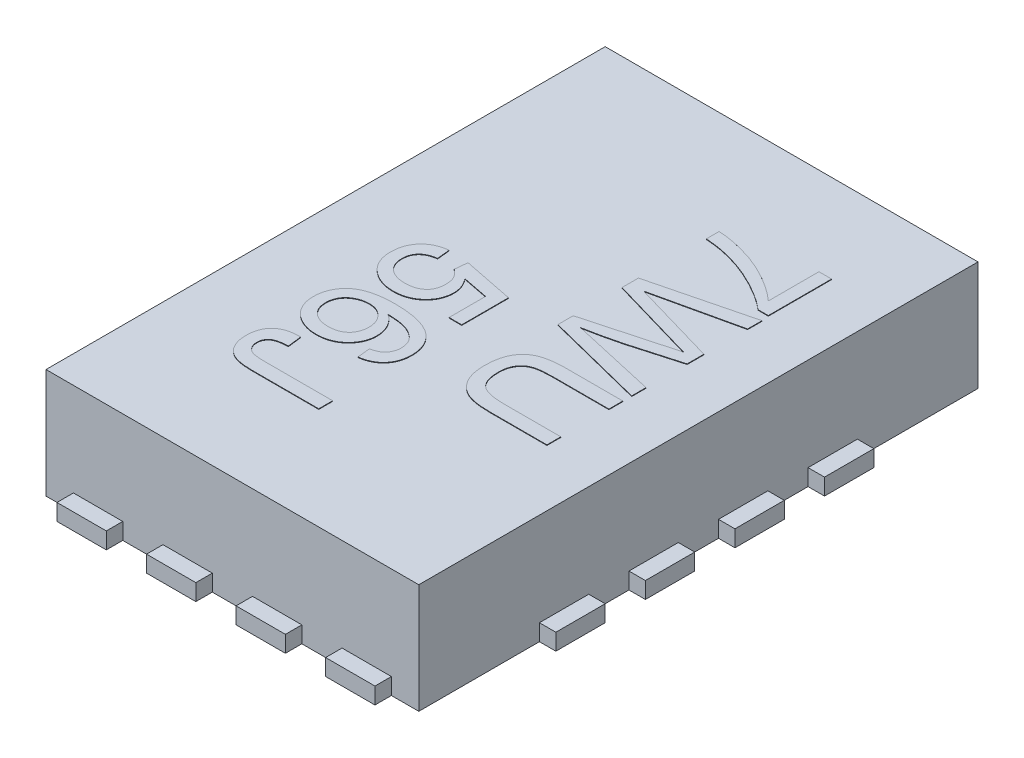
from build123d import *

# Parameters (mm, degrees)
SKETCH1_W           = 1.7272
SKETCH1_H           = 2.5908
BOSS_EXTRUDE1_DEPTH = 0.508
SKETCH2_W           = 0.2286
SKETCH2_H           = 0.0762
BOSS_EXTRUDE3_DEPTH = 0.0762
SKETCH4_W           = 0.2286
SKETCH4_H           = 0.0762
BOSS_EXTRUDE4_DEPTH = 0.0762
BOSS_EXTRUDE5_DEPTH = 0.00254


with BuildPart() as part:
    # Sketch1 → Boss-Extrude1 (new body)
    with BuildSketch(Plane(origin=(0, 0, 0), x_dir=(1, 0, 0), z_dir=(0, 1, 0))):
        Rectangle(SKETCH1_W, SKETCH1_H)
    extrude(amount=BOSS_EXTRUDE1_DEPTH)

    # Sketch2 → Boss-Extrude3 (add)
    with BuildSketch(Plane.XY.offset(1.2954)):
        with Locations((-0.6223, 0.0381)):
            Rectangle(SKETCH2_W, SKETCH2_H)
        with Locations((-0.207433333, 0.0381)):
            Rectangle(SKETCH2_W, SKETCH2_H)
        with Locations((0.207433333, 0.0381)):
            Rectangle(SKETCH2_W, SKETCH2_H)
        with Locations((0.6223, 0.0381)):
            Rectangle(SKETCH2_W, SKETCH2_H)
    boss_extrude3 = extrude(amount=BOSS_EXTRUDE3_DEPTH)

    # Sketch4 → Boss-Extrude4 (add)
    with BuildSketch(Plane(origin=(0.8636, 0, 0), x_dir=(0, 0, -1), z_dir=(1, 0, 0))):
        with Locations((-0.207433291, 0.0381)):
            Rectangle(SKETCH4_W, SKETCH4_H)
        with Locations((0.207433291, 0.0381)):
            Rectangle(SKETCH4_W, SKETCH4_H)
        with Locations((0.622299873, 0.0381)):
            Rectangle(SKETCH4_W, SKETCH4_H)
        with Locations((-0.622299873, 0.0381)):
            Rectangle(SKETCH4_W, SKETCH4_H)
    boss_extrude4 = extrude(amount=BOSS_EXTRUDE4_DEPTH)

    # Mirror1: Boss-Extrude3 across plane
    add(boss_extrude3.mirror(Plane.XY))

    # Mirror2: Boss-Extrude4 across plane
    add(boss_extrude4.mirror(Plane(origin=(0, 0, 0), x_dir=(0, 0, 1), z_dir=(1, 0, 0))))

    # Sketch5 → Boss-Extrude5 (add)
    # profile 1 of 6: a face of its own
    with BuildSketch(Plane(origin=(0, 0.508, 0), x_dir=(1, 0, 0), z_dir=(0, 1, 0))):
        with BuildLine():
            Line((0.537145835, 0.884876602), (0.595761219, 0.884876602))
            Line((0.595761219, 0.884876602), (0.595761219, 0.591799679))
            Line((0.595761219, 0.591799679), (0.548319392, 0.591799679))
            add(Edge.make_bspline(
                [(0.548319392, 0.591799679), (0.544283142, 0.595247968), (0.536030427, 0.602298507), (0.522927148, 0.612539534), (0.508844527, 0.622683272), (0.493961555, 0.632958527), (0.478101801, 0.643119637), (0.461278077, 0.65315955), (0.443649517, 0.663358137), (0.41891854, 0.676702222), (0.387240127, 0.692606897), (0.34827942, 0.709294552), (0.308858238, 0.72395699), (0.282067646, 0.731780241), (0.268705691, 0.735682131)],
                knots=[0, 0, 0, 0, 0.60330726, 1.233551424, 1.889416397, 2.575628689, 3.288828609, 4.029674647, 4.802190479, 5.603311629, 7.223308675, 8.828846205, 10.41836952, 12, 12, 12, 12], degree=3))
            add(Edge.make_bspline(
                [(0.268705691, 0.735682131), (0.259054976, 0.738211203), (0.239421839, 0.743356273), (0.208934063, 0.74898854), (0.177145965, 0.753343118), (0.15545476, 0.755053081), (0.144422758, 0.755922756)],
                knots=[0, 0, 0, 0, 0.948866074, 1.930345965, 2.947387709, 4, 4, 4, 4], degree=3))
            Line((0.144422758, 0.755922756), (0.144422758, 0.814538141))
            add(Edge.make_bspline(
                [(0.144422758, 0.814538141), (0.148973928, 0.814397417), (0.158333142, 0.814108028), (0.172715039, 0.812831663), (0.18780958, 0.811119975), (0.203581408, 0.808749386), (0.220016376, 0.805548896), (0.237180677, 0.801904926), (0.255069397, 0.79772375), (0.279754633, 0.791064695), (0.310880897, 0.78159117), (0.347700285, 0.76778436), (0.383834029, 0.751759752), (0.413156931, 0.736495121), (0.435988662, 0.723471366), (0.452555187, 0.713588996), (0.468341163, 0.70342538), (0.483460265, 0.693169217), (0.497925196, 0.68281866), (0.511600754, 0.672162879), (0.52476168, 0.66151604), (0.533054189, 0.654082756), (0.537145835, 0.650415064)],
                knots=[0, 0, 0, 0, 0.630331972, 1.296240579, 1.998302801, 2.733604721, 3.503764187, 4.316226446, 5.163113184, 6.046948427, 7.855966888, 9.665696345, 11.488019414, 13.325647182, 14.24001658, 15.127322129, 15.996171708, 16.839125122, 17.656782808, 18.458307534, 19.239306169, 20, 20, 20, 20], degree=3))
            Line((0.537145835, 0.650415064), (0.537145835, 0.884876602))
        make_face()
    # profile 2 of 6: a face of its own
    with BuildSketch(Plane(origin=(0, 0.508, 0), x_dir=(1, 0, 0), z_dir=(0, 1, 0))):
        with BuildLine():
            Line((0.144422758, 0.44150617), (0.601622758, 0.556630449))
            Line((0.601622758, 0.556630449), (0.601622758, 0.490047035))
            Line((0.601622758, 0.490047035), (0.300944152, 0.42218141))
            add(Edge.make_bspline(
                [(0.300944152, 0.42218141), (0.285436942, 0.418664191), (0.254580837, 0.411665662), (0.223707586, 0.404743168), (0.208350162, 0.401299679)],
                knots=[0, 0, 0, 0, 1.00513078, 2, 2, 2, 2], degree=3))
            add(Edge.make_bspline(
                [(0.208350162, 0.401299679), (0.213872311, 0.399669296), (0.224297123, 0.396591429), (0.239075299, 0.392430749), (0.25197328, 0.388651736), (0.263051194, 0.385432212), (0.272324606, 0.382825375), (0.279679564, 0.380574662), (0.285260103, 0.379040604), (0.288336672, 0.378131519), (0.289587421, 0.377761939)],
                knots=[0, 0, 0, 0, 1.633809233, 3.084334118, 4.356383392, 5.447555203, 6.357852567, 7.089694452, 7.629924063, 8, 8, 8, 8], degree=3))
            Line((0.289587421, 0.377761939), (0.601622758, 0.287457612))
            Line((0.601622758, 0.287457612), (0.601622758, 0.209883814))
            Line((0.601622758, 0.209883814), (0.372564825, 0.144582612))
            add(Edge.make_bspline(
                [(0.372564825, 0.144582612), (0.358414524, 0.140978895), (0.330513194, 0.133873145), (0.288953128, 0.124432009), (0.248401319, 0.115718142), (0.221580712, 0.110698792), (0.208350162, 0.108222756)],
                knots=[0, 0, 0, 0, 1.04154457, 2.053700482, 3.039894486, 4, 4, 4, 4], degree=3))
            add(Edge.make_bspline(
                [(0.208350162, 0.108222756), (0.215127144, 0.10669444), (0.229382051, 0.103479734), (0.251889306, 0.098445242), (0.276548659, 0.092853685), (0.293738742, 0.088986911), (0.302684296, 0.086974679)],
                knots=[0, 0, 0, 0, 0.862132589, 1.813435466, 2.862132822, 4, 4, 4, 4], degree=3))
            Line((0.302684296, 0.086974679), (0.601622758, 0.019475401))
            Line((0.601622758, 0.019475401), (0.601622758, -0.047108013))
            Line((0.601622758, -0.047108013), (0.144422758, 0.068107852))
            Line((0.144422758, 0.068107852), (0.144422758, 0.138995833))
            Line((0.144422758, 0.138995833), (0.493825402, 0.234520593))
            add(Edge.make_bspline(
                [(0.493825402, 0.234520593), (0.497241138, 0.235479799), (0.503729763, 0.237301934), (0.512989252, 0.239690325), (0.521132592, 0.242058821), (0.528265021, 0.243942726), (0.534314667, 0.245573088), (0.539263819, 0.247016844), (0.543209338, 0.247945428), (0.545451854, 0.248616937), (0.546396075, 0.248899679)],
                knots=[0, 0, 0, 0, 1.562239628, 2.967673567, 4.210417925, 5.296319877, 6.215971374, 6.969386481, 7.566055473, 8, 8, 8, 8], degree=3))
            add(Edge.make_bspline(
                [(0.546396075, 0.248899679), (0.540408278, 0.250594986), (0.529094284, 0.253798282), (0.513166549, 0.258542216), (0.499161243, 0.262522874), (0.490496621, 0.265045509), (0.486498479, 0.266209535)],
                knots=[0, 0, 0, 0, 1.197730334, 2.263121701, 3.198547257, 4, 4, 4, 4], degree=3))
            Line((0.486498479, 0.266209535), (0.144422758, 0.365214583))
            Line((0.144422758, 0.365214583), (0.144422758, 0.44150617))
        make_face()
    # profile 3 of 6: a face of its own
    with BuildSketch(Plane(origin=(0, 0.508, 0), x_dir=(1, 0, 0), z_dir=(0, 1, 0))):
        with BuildLine():
            Line((0.601622758, -0.375354167), (0.601622758, -0.43983109))
            Line((0.601622758, -0.43983109), (0.338586219, -0.43983109))
            add(Edge.make_bspline(
                [(0.338586219, -0.43983109), (0.332998986, -0.439764099), (0.322126222, -0.439633736), (0.306269248, -0.439035803), (0.291294397, -0.437865088), (0.277221251, -0.436091632), (0.264010943, -0.434028376), (0.251675192, -0.431492111), (0.240247072, -0.428370628), (0.229590771, -0.424832249), (0.21966058, -0.420525846), (0.210197846, -0.415637825), (0.201296514, -0.409798826), (0.192842842, -0.403279952), (0.184823947, -0.396014268), (0.177326914, -0.387924883), (0.170270374, -0.379101046), (0.163632482, -0.36957618), (0.157685929, -0.359236558), (0.152525786, -0.348084867), (0.148255661, -0.336112547), (0.14467112, -0.32338861), (0.141970882, -0.309877772), (0.139940213, -0.295633343), (0.138742669, -0.280613367), (0.138622598, -0.270337098), (0.138561219, -0.265083974)],
                knots=[0, 0, 0, 0, 1.311228972, 2.551653728, 3.723130164, 4.834785825, 5.879510353, 6.860250358, 7.788314549, 8.658288427, 9.492697459, 10.325875345, 11.154513055, 11.987074685, 12.828985206, 13.690719442, 14.572384718, 15.478595216, 16.41253076, 17.367739602, 18.35808817, 19.392369757, 20.467218117, 21.588802345, 22.767420464, 24, 24, 24, 24], degree=3))
            add(Edge.make_bspline(
                [(0.138561219, -0.265083974), (0.138636714, -0.259953671), (0.13878381, -0.249957674), (0.139779092, -0.235309543), (0.141541138, -0.22137549), (0.143859056, -0.208115575), (0.146974066, -0.195595103), (0.150849692, -0.183829034), (0.155319842, -0.172740695), (0.160423599, -0.162316614), (0.166361624, -0.15271239), (0.172703313, -0.14368057), (0.179849464, -0.135488333), (0.187530856, -0.127977951), (0.195810625, -0.121138203), (0.204767733, -0.115103119), (0.214273716, -0.109638778), (0.224574267, -0.105103584), (0.235568204, -0.101008522), (0.24748714, -0.097578566), (0.260358636, -0.094634606), (0.274161328, -0.092335315), (0.28890362, -0.090328979), (0.304623952, -0.089162587), (0.321296774, -0.088274936), (0.332723322, -0.088184952), (0.338586219, -0.088138782)],
                knots=[0, 0, 0, 0, 1.193081066, 2.324625372, 3.412172001, 4.45804146, 5.453311625, 6.409738988, 7.336564304, 8.231938232, 9.104965612, 9.959995908, 10.795526766, 11.6289435, 12.456168255, 13.289131264, 14.138038169, 15.002361749, 15.903123796, 16.86470204, 17.884288495, 18.972113175, 20.117801365, 21.342981521, 22.636698715, 24, 24, 24, 24], degree=3))
            Line((0.338586219, -0.088138782), (0.601622758, -0.088138782))
            Line((0.601622758, -0.088138782), (0.601622758, -0.152615705))
            Line((0.601622758, -0.152615705), (0.341608575, -0.152615705))
            add(Edge.make_bspline(
                [(0.341608575, -0.152615705), (0.336876374, -0.152657835), (0.327745522, -0.152739126), (0.314518454, -0.153163245), (0.302243824, -0.154011424), (0.290902854, -0.155059954), (0.280536629, -0.156501636), (0.271159899, -0.158347392), (0.262742136, -0.160419199), (0.252893564, -0.163515424), (0.241942854, -0.16868671), (0.230195357, -0.176671173), (0.220173688, -0.186682764), (0.211772221, -0.198446392), (0.205163993, -0.211808174), (0.200531441, -0.226673821), (0.197628299, -0.242898482), (0.197330537, -0.254202793), (0.197176604, -0.260046715)],
                knots=[0, 0, 0, 0, 1.09016621, 2.103491781, 3.048002782, 3.92413717, 4.726764113, 5.45776374, 6.124688997, 6.722968542, 7.833563451, 8.900618832, 9.979749949, 11.078524919, 12.217069639, 13.398089285, 14.65490594, 16, 16, 16, 16], degree=3))
            add(Edge.make_bspline(
                [(0.197176604, -0.260046715), (0.197261786, -0.265056097), (0.197426265, -0.274728706), (0.19875553, -0.288675814), (0.201172045, -0.301463834), (0.204313974, -0.313218044), (0.208515275, -0.323854078), (0.213633377, -0.333396433), (0.21978326, -0.341735607), (0.22683241, -0.349187196), (0.235399709, -0.355547227), (0.245634815, -0.360776169), (0.257442423, -0.365365738), (0.270974129, -0.369090944), (0.286250445, -0.371818664), (0.303182432, -0.373947246), (0.321841593, -0.375064251), (0.334829903, -0.375254746), (0.341608575, -0.375354167)],
                knots=[0, 0, 0, 0, 1.111455303, 2.146107705, 3.104026802, 3.996399357, 4.841714416, 5.635894114, 6.391918333, 7.134500369, 7.904030117, 8.746408724, 9.677288091, 10.711075296, 11.855002337, 13.117843725, 14.495786417, 16, 16, 16, 16], degree=3))
            Line((0.341608575, -0.375354167), (0.601622758, -0.375354167))
        make_face()
    # profile 4 of 6: a face of its own
    with BuildSketch(Plane(origin=(0, 0.508, 0), x_dir=(1, 0, 0), z_dir=(0, 1, 0))):
        with BuildLine():
            Line((-0.401239238, -0.577500811), (-0.394003901, -0.641977734))
            add(Edge.make_bspline(
                [(-0.394003901, -0.641977734), (-0.398066752, -0.64215194), (-0.405838879, -0.64248519), (-0.416996834, -0.643590044), (-0.427145267, -0.645132391), (-0.436321246, -0.647042342), (-0.444531119, -0.649267402), (-0.451708723, -0.652059079), (-0.458004624, -0.655065785), (-0.463223731, -0.658762264), (-0.467682355, -0.662726528), (-0.471474847, -0.667084003), (-0.474666823, -0.67177237), (-0.477411359, -0.676765901), (-0.479384671, -0.68221708), (-0.480833459, -0.687986768), (-0.481810817, -0.694118756), (-0.481887459, -0.698330039), (-0.481926978, -0.700501532)],
                knots=[0, 0, 0, 0, 1.63255286, 3.123030932, 4.49951906, 5.752042824, 6.885216223, 7.909610261, 8.841530719, 9.678034765, 10.467978015, 11.232499557, 11.990705893, 12.742044187, 13.51390061, 14.310662005, 15.128914839, 16, 16, 16, 16], degree=3))
            add(Edge.make_bspline(
                [(-0.481926978, -0.700501532), (-0.481820793, -0.703658514), (-0.481613308, -0.709827253), (-0.479498706, -0.718681472), (-0.47627901, -0.72693342), (-0.471721659, -0.734407621), (-0.465966674, -0.740933911), (-0.459337481, -0.746565883), (-0.451593154, -0.75081231), (-0.444507267, -0.753620513), (-0.438163572, -0.755297885), (-0.432634945, -0.756231181), (-0.426505616, -0.757188609), (-0.419684281, -0.757863389), (-0.412211043, -0.758567328), (-0.404048707, -0.758845454), (-0.395258102, -0.759171581), (-0.389180761, -0.759195912), (-0.386035872, -0.759208503)],
                knots=[0, 0, 0, 0, 1.177282391, 2.300408846, 3.380386581, 4.475609283, 5.550517805, 6.619299368, 7.707015968, 8.833610655, 9.458733008, 10.154353913, 10.926859838, 11.775644792, 12.714142741, 13.730089572, 14.82537164, 16, 16, 16, 16], degree=3))
            Line((-0.386035872, -0.759208503), (-0.071619286, -0.759208503))
            Line((-0.071619286, -0.759208503), (-0.071619286, -0.823685426))
            Line((-0.071619286, -0.823685426), (-0.381914478, -0.823685426))
            add(Edge.make_bspline(
                [(-0.381914478, -0.823685426), (-0.386555547, -0.823659006), (-0.395537242, -0.823607875), (-0.408615208, -0.82296621), (-0.42089058, -0.82184447), (-0.432395427, -0.820453263), (-0.443081128, -0.818484188), (-0.452977936, -0.816252579), (-0.462077484, -0.813518791), (-0.47295431, -0.809286558), (-0.4853345, -0.802849017), (-0.498322596, -0.792856818), (-0.5095868, -0.781027007), (-0.518732573, -0.767155117), (-0.525854923, -0.751686701), (-0.530965478, -0.734863389), (-0.534171711, -0.716773088), (-0.534508008, -0.704270412), (-0.534680824, -0.697845522)],
                knots=[0, 0, 0, 0, 0.979138624, 1.89489171, 2.761458997, 3.579560347, 4.338878061, 5.052915979, 5.71922422, 6.341219979, 7.513897407, 8.648873756, 9.783411367, 10.9446051, 12.137660755, 13.364187162, 14.645505386, 16, 16, 16, 16], degree=3))
            add(Edge.make_bspline(
                [(-0.534680824, -0.697845522), (-0.534575642, -0.693078128), (-0.53437076, -0.683791781), (-0.53277569, -0.670316629), (-0.530303691, -0.657641905), (-0.526456525, -0.645910313), (-0.52186193, -0.634911336), (-0.516032865, -0.624881324), (-0.509199993, -0.615702032), (-0.501280286, -0.607448661), (-0.492348186, -0.600034304), (-0.482300901, -0.593760614), (-0.471314644, -0.5883496), (-0.459218439, -0.584237105), (-0.446188879, -0.580873802), (-0.432069312, -0.578791088), (-0.416989049, -0.577423809), (-0.406585073, -0.577474675), (-0.401239238, -0.577500811)],
                knots=[0, 0, 0, 0, 1.110296574, 2.162732441, 3.157221742, 4.113121602, 5.033902568, 5.929283926, 6.808331651, 7.693657651, 8.587880195, 9.505359283, 10.446863844, 11.434309352, 12.476166735, 13.577612903, 14.755313945, 16, 16, 16, 16], degree=3))
        make_face()
    # profile 5 of 6: a face of its own
    with BuildSketch(Plane(origin=(0, 0.508, 0), x_dir=(1, 0, 0), z_dir=(0, 1, 0))):
        with BuildLine():
            Line((-0.188850055, -0.524746965), (-0.194711593, -0.46613158))
            add(Edge.make_bspline(
                [(-0.194711593, -0.46613158), (-0.189670357, -0.464866707), (-0.180181007, -0.462485779), (-0.167310135, -0.457492994), (-0.156423566, -0.451991052), (-0.150561449, -0.44721106), (-0.147819286, -0.44497509)],
                knots=[0, 0, 0, 0, 1.199207122, 2.257322842, 3.184815751, 4, 4, 4, 4], degree=3))
            add(Edge.make_bspline(
                [(-0.147819286, -0.44497509), (-0.14594898, -0.443055769), (-0.142270521, -0.439280911), (-0.137475624, -0.433083966), (-0.133413146, -0.426551361), (-0.130121923, -0.419663351), (-0.127522046, -0.412457149), (-0.125703294, -0.404902904), (-0.124577383, -0.39701773), (-0.124441795, -0.391644969), (-0.124373132, -0.388924128)],
                knots=[0, 0, 0, 0, 1.028360939, 2.022547923, 3.001693811, 3.976902288, 4.948369586, 5.937776631, 6.955661634, 8, 8, 8, 8], degree=3))
            add(Edge.make_bspline(
                [(-0.124373132, -0.388924128), (-0.124515159, -0.384513178), (-0.124795798, -0.375797332), (-0.127543237, -0.363009629), (-0.131655217, -0.350589175), (-0.135823556, -0.342894245), (-0.137927939, -0.339009465)],
                knots=[0, 0, 0, 0, 1.010336883, 1.996381556, 2.988474728, 4, 4, 4, 4], degree=3))
            add(Edge.make_bspline(
                [(-0.137927939, -0.339009465), (-0.141094407, -0.335190785), (-0.147594406, -0.327351948), (-0.15956938, -0.31709967), (-0.173609337, -0.30807308), (-0.186619957, -0.301283532), (-0.198345096, -0.296574565), (-0.208335844, -0.293354954), (-0.219437587, -0.290771438), (-0.231542273, -0.28857158), (-0.244692209, -0.286884173), (-0.258888697, -0.285469394), (-0.274169837, -0.284687893), (-0.284709872, -0.284513706), (-0.290144766, -0.284423888)],
                knots=[0, 0, 0, 0, 1.063450586, 2.183009608, 3.366294357, 4.641264713, 5.326401404, 6.07664488, 6.892063598, 7.77129542, 8.7166684, 9.737191916, 10.833199044, 12, 12, 12, 12], degree=3))
            add(Edge.make_bspline(
                [(-0.290144766, -0.284423888), (-0.285290978, -0.287880807), (-0.275789392, -0.294647939), (-0.263319063, -0.306582026), (-0.252872933, -0.319694048), (-0.24444528, -0.333839733), (-0.237970179, -0.348706576), (-0.233253319, -0.363964328), (-0.230399213, -0.379628053), (-0.230054499, -0.390194659), (-0.229880824, -0.395518359)],
                knots=[0, 0, 0, 0, 1.084049016, 2.12209208, 3.130949879, 4.128207417, 5.11149915, 6.076901555, 7.031098562, 8, 8, 8, 8], degree=3))
            add(Edge.make_bspline(
                [(-0.229880824, -0.395518359), (-0.230003818, -0.400103762), (-0.230246817, -0.409163096), (-0.232183696, -0.422501417), (-0.235534791, -0.435271163), (-0.240005225, -0.44759122), (-0.245937896, -0.459298571), (-0.252995132, -0.470591935), (-0.261535712, -0.481220454), (-0.271139768, -0.491326344), (-0.281815204, -0.500528235), (-0.293305578, -0.508672331), (-0.305637756, -0.515459155), (-0.318729328, -0.520962468), (-0.332532608, -0.525269777), (-0.347086807, -0.528399548), (-0.362420686, -0.530231674), (-0.37290354, -0.53048121), (-0.378251016, -0.530608503)],
                knots=[0, 0, 0, 0, 0.981571796, 1.939281725, 2.877861438, 3.804367779, 4.739823863, 5.68285443, 6.650639019, 7.653910388, 8.664247958, 9.663507932, 10.664113941, 11.671783641, 12.699293534, 13.755733966, 14.85516306, 16, 16, 16, 16], degree=3))
            add(Edge.make_bspline(
                [(-0.378251016, -0.530608503), (-0.385317514, -0.530379204), (-0.399263076, -0.529926687), (-0.4198103, -0.526332004), (-0.43956272, -0.52044694), (-0.455345848, -0.513693886), (-0.467234283, -0.50710313), (-0.475716966, -0.501809781), (-0.483610334, -0.495985048), (-0.491056659, -0.489819221), (-0.497809345, -0.483043447), (-0.504201503, -0.476046384), (-0.509860331, -0.468439435), (-0.51510775, -0.460530922), (-0.519647165, -0.452159156), (-0.523711455, -0.443557744), (-0.527108367, -0.43464688), (-0.529832612, -0.425450424), (-0.532062925, -0.416009629), (-0.533600485, -0.406275203), (-0.534547722, -0.396270176), (-0.534636113, -0.389506309), (-0.534680824, -0.386084946)],
                knots=[0, 0, 0, 0, 1.777725645, 3.508298892, 5.231915806, 6.956149154, 7.815891424, 8.651536337, 9.470662572, 10.283276216, 11.081966684, 11.876395462, 12.66627801, 13.465448804, 14.263251756, 15.060721634, 15.858413576, 16.660607494, 17.473221138, 18.298093177, 19.139125428, 20, 20, 20, 20], degree=3))
            add(Edge.make_bspline(
                [(-0.534680824, -0.386084946), (-0.534520195, -0.380307052), (-0.534205173, -0.368975587), (-0.531796727, -0.352387567), (-0.527734678, -0.336619332), (-0.522164534, -0.321643416), (-0.514965978, -0.30749218), (-0.50607455, -0.294214705), (-0.495600277, -0.281753848), (-0.48353782, -0.270092003), (-0.469568241, -0.259557115), (-0.453561471, -0.250373089), (-0.435384631, -0.242850422), (-0.415264558, -0.236496615), (-0.393010912, -0.231792395), (-0.368767436, -0.228164417), (-0.342440694, -0.226256202), (-0.324217614, -0.225961238), (-0.314781545, -0.225808503)],
                knots=[0, 0, 0, 0, 0.898449204, 1.762016875, 2.600428026, 3.426826527, 4.242280324, 5.064055083, 5.906691075, 6.769749479, 7.668135943, 8.621070442, 9.631748766, 10.722023185, 11.898351526, 13.165512303, 14.532277789, 16, 16, 16, 16], degree=3))
            add(Edge.make_bspline(
                [(-0.314781545, -0.225808503), (-0.309408144, -0.225845349), (-0.29881112, -0.225918012), (-0.28320171, -0.226441364), (-0.268148016, -0.227473293), (-0.253669667, -0.228829676), (-0.239743485, -0.230577311), (-0.226378496, -0.232628749), (-0.213593405, -0.235246084), (-0.20135997, -0.238125911), (-0.18966979, -0.241466727), (-0.17850812, -0.245056843), (-0.167956737, -0.249223508), (-0.157951716, -0.253695562), (-0.148507715, -0.258561914), (-0.139588435, -0.263742637), (-0.131308287, -0.269469486), (-0.126121992, -0.273588141), (-0.123548853, -0.27563158)],
                knots=[0, 0, 0, 0, 1.280444348, 2.525197649, 3.720942618, 4.875526429, 5.989898656, 7.065115415, 8.096622082, 9.098853712, 10.059152529, 10.993162051, 11.891531392, 12.760921141, 13.603603485, 14.422073071, 15.217123906, 16, 16, 16, 16], degree=3))
            add(Edge.make_bspline(
                [(-0.123548853, -0.27563158), (-0.119395776, -0.279323851), (-0.111209675, -0.286601659), (-0.100635172, -0.299051701), (-0.091602919, -0.312318269), (-0.084305641, -0.32661295), (-0.078616449, -0.341826488), (-0.0744866, -0.35796842), (-0.072091572, -0.375083791), (-0.071779266, -0.386779546), (-0.071619286, -0.392770763)],
                knots=[0, 0, 0, 0, 1.005002357, 1.980952959, 2.948226316, 3.90482984, 4.879026092, 5.883055346, 6.915583142, 8, 8, 8, 8], degree=3))
            add(Edge.make_bspline(
                [(-0.071619286, -0.392770763), (-0.071698145, -0.397231889), (-0.071853069, -0.405996131), (-0.073339588, -0.418837981), (-0.07582408, -0.431052838), (-0.079175383, -0.442667907), (-0.083636394, -0.453615648), (-0.088923176, -0.464022277), (-0.095282842, -0.473782122), (-0.102628506, -0.482824528), (-0.110751937, -0.491171891), (-0.119721353, -0.498648509), (-0.129424963, -0.505226209), (-0.139882949, -0.510956429), (-0.151045806, -0.515787966), (-0.16296151, -0.519754898), (-0.175627001, -0.522770031), (-0.184381274, -0.524078853), (-0.188850055, -0.524746965)],
                knots=[0, 0, 0, 0, 1.095988384, 2.15315746, 3.171326302, 4.156539379, 5.119213808, 6.072133135, 7.021027441, 7.975952916, 8.930907862, 9.879001051, 10.840359051, 11.807350428, 12.805278655, 13.825435679, 14.889953203, 16, 16, 16, 16], degree=3))
        make_face()
        with BuildLine():
            add(Edge.make_bspline(
                [(-0.377060391, -0.284423888), (-0.381649949, -0.284586924), (-0.390768813, -0.284910857), (-0.404304202, -0.28738857), (-0.417510442, -0.29143485), (-0.430240864, -0.296980324), (-0.442068718, -0.303827963), (-0.452549013, -0.311961361), (-0.461527872, -0.321203976), (-0.469024779, -0.331506136), (-0.474785945, -0.342843658), (-0.478958527, -0.355013485), (-0.48148045, -0.368030156), (-0.481775887, -0.377006548), (-0.481926978, -0.381597205)],
                knots=[0, 0, 0, 0, 1.034121613, 2.054667162, 3.090870403, 4.141799978, 5.178094622, 6.163726224, 7.122467907, 8.07367165, 9.024701118, 9.977919151, 10.965878387, 12, 12, 12, 12], degree=3))
            add(Edge.make_bspline(
                [(-0.481926978, -0.381597205), (-0.481838902, -0.384868725), (-0.481666986, -0.391254443), (-0.480323211, -0.400601566), (-0.478292239, -0.409501671), (-0.475183807, -0.417912977), (-0.47137873, -0.425894066), (-0.466622635, -0.433405203), (-0.461048848, -0.440448429), (-0.454622277, -0.446947758), (-0.447476749, -0.452822518), (-0.439653807, -0.457926701), (-0.431282784, -0.462434228), (-0.422157795, -0.465824594), (-0.41251266, -0.468587255), (-0.402256168, -0.470618338), (-0.391376546, -0.471810797), (-0.383901866, -0.471931465), (-0.380082747, -0.471993119)],
                knots=[0, 0, 0, 0, 1.023462019, 1.997707343, 2.950204755, 3.875082018, 4.798131411, 5.712685617, 6.65128003, 7.603921197, 8.567945975, 9.540503156, 10.523517238, 11.53671457, 12.580096959, 13.661292135, 14.805058716, 16, 16, 16, 16], degree=3))
            add(Edge.make_bspline(
                [(-0.380082747, -0.471993119), (-0.376415331, -0.471935881), (-0.369243237, -0.471823946), (-0.358777142, -0.470566401), (-0.348884786, -0.468730645), (-0.33964115, -0.46592614), (-0.330990954, -0.462444137), (-0.322879009, -0.458247529), (-0.31540346, -0.453180092), (-0.308644842, -0.447277857), (-0.302498711, -0.440807803), (-0.29712135, -0.433697326), (-0.292664404, -0.425983302), (-0.288938999, -0.417742965), (-0.286113019, -0.408918598), (-0.284149129, -0.399523512), (-0.28277978, -0.389605224), (-0.282683782, -0.38279272), (-0.28263467, -0.379307542)],
                knots=[0, 0, 0, 0, 1.155383407, 2.259498055, 3.31823029, 4.322885379, 5.298549415, 6.25407473, 7.196229935, 8.137696897, 9.077096105, 10.004740892, 10.940535275, 11.8794908, 12.850254721, 13.854356636, 14.902319961, 16, 16, 16, 16], degree=3))
            add(Edge.make_bspline(
                [(-0.28263467, -0.379307542), (-0.282685275, -0.376066281), (-0.282784998, -0.369679069), (-0.284166001, -0.36031256), (-0.286130322, -0.351283638), (-0.288998027, -0.342635435), (-0.292644999, -0.334363101), (-0.297219862, -0.32651694), (-0.30249779, -0.318990917), (-0.308658073, -0.311987381), (-0.315335006, -0.305503751), (-0.322650743, -0.299856464), (-0.330466497, -0.295101709), (-0.338779136, -0.291079487), (-0.347653092, -0.288106102), (-0.357014833, -0.285999007), (-0.366857471, -0.284690533), (-0.373606504, -0.284514153), (-0.377060391, -0.284423888)],
                knots=[0, 0, 0, 0, 1.037172838, 2.043847658, 3.025909439, 3.99370322, 4.956694024, 5.916004533, 6.898066313, 7.896061507, 8.898787354, 9.874696845, 10.848988603, 11.824261125, 12.826080801, 13.838909816, 14.894039933, 16, 16, 16, 16], degree=3))
        make_face(mode=Mode.SUBTRACT)
    # profile 6 of 6: a face of its own
    with BuildSketch(Plane(origin=(0, 0.508, 0), x_dir=(1, 0, 0), z_dir=(0, 1, 0))):
        with BuildLine():
            Line((-0.405726978, 0.114160728), (-0.399865439, 0.055545343))
            add(Edge.make_bspline(
                [(-0.399865439, 0.055545343), (-0.403168095, 0.054964959), (-0.409592273, 0.053836021), (-0.418891461, 0.051684705), (-0.427530667, 0.048890758), (-0.435584711, 0.045751452), (-0.442968431, 0.042019856), (-0.449798413, 0.037976641), (-0.455832214, 0.033208495), (-0.461385407, 0.028195431), (-0.466278752, 0.022693209), (-0.47040401, 0.016648738), (-0.474003049, 0.010230662), (-0.476949781, 0.003360813), (-0.479106634, -0.00397134), (-0.480812335, -0.011672477), (-0.481671829, -0.019841765), (-0.481840841, -0.025415614), (-0.481926978, -0.02825634)],
                knots=[0, 0, 0, 0, 1.237781394, 2.407677316, 3.51963579, 4.58689595, 5.594855907, 6.570874, 7.510833816, 8.428091223, 9.330271693, 10.221190844, 11.124215526, 12.043132878, 12.973586933, 13.941700858, 14.950982896, 16, 16, 16, 16], degree=3))
            add(Edge.make_bspline(
                [(-0.481926978, -0.02825634), (-0.481842772, -0.031741274), (-0.481678103, -0.038556214), (-0.480285401, -0.048470661), (-0.477988997, -0.057835659), (-0.47477535, -0.066606398), (-0.470778799, -0.074885699), (-0.465603994, -0.082398899), (-0.459787002, -0.089555661), (-0.452852031, -0.095895445), (-0.445302157, -0.101666429), (-0.437061148, -0.106647223), (-0.428244673, -0.110840347), (-0.418854423, -0.114370499), (-0.408836755, -0.116977259), (-0.39824496, -0.118894742), (-0.387072292, -0.120125689), (-0.379414395, -0.120241609), (-0.37550342, -0.120300811)],
                knots=[0, 0, 0, 0, 1.052816602, 2.058828735, 3.018813999, 3.961574988, 4.877590722, 5.788574389, 6.712363302, 7.658909047, 8.620312049, 9.580784896, 10.562948504, 11.56722449, 12.607883026, 13.686460295, 14.818448981, 16, 16, 16, 16], degree=3))
            add(Edge.make_bspline(
                [(-0.37550342, -0.120300811), (-0.371776312, -0.120233523), (-0.364518768, -0.120102499), (-0.353950578, -0.118999057), (-0.344013281, -0.11713742), (-0.334597351, -0.114728637), (-0.325849923, -0.111408432), (-0.317644168, -0.107470483), (-0.310154236, -0.10264633), (-0.303146919, -0.097279142), (-0.296865142, -0.091149135), (-0.291560976, -0.084173494), (-0.28691876, -0.07662587), (-0.283154212, -0.068354245), (-0.280357295, -0.05935375), (-0.278205319, -0.049713823), (-0.277073467, -0.039334437), (-0.276875042, -0.032196906), (-0.276773132, -0.028531099)],
                knots=[0, 0, 0, 0, 1.165854935, 2.270189951, 3.319242023, 4.32700288, 5.306253956, 6.24172124, 7.169108591, 8.088047231, 8.999810445, 9.905349262, 10.822648491, 11.767237767, 12.739852311, 13.766490849, 14.852878837, 16, 16, 16, 16], degree=3))
            add(Edge.make_bspline(
                [(-0.276773132, -0.028531099), (-0.276909961, -0.023973572), (-0.277173274, -0.015203154), (-0.279284296, -0.002632122), (-0.282810237, 0.008788002), (-0.287965292, 0.018943999), (-0.294155297, 0.028037581), (-0.301155746, 0.036236536), (-0.308966264, 0.043607209), (-0.314846514, 0.04765036), (-0.317803901, 0.049683804)],
                knots=[0, 0, 0, 0, 1.182839217, 2.276233246, 3.299105702, 4.274010162, 5.221622004, 6.149363738, 7.06924902, 8, 8, 8, 8], degree=3))
            Line((-0.317803901, 0.049683804), (-0.311942363, 0.108299189))
            Line((-0.311942363, 0.108299189), (-0.077480824, 0.061406881))
            Line((-0.077480824, 0.061406881), (-0.077480824, -0.155470042))
            Line((-0.077480824, -0.155470042), (-0.136096209, -0.155470042))
            Line((-0.136096209, -0.155470042), (-0.136096209, 0.013507122))
            Line((-0.136096209, 0.013507122), (-0.254517603, 0.036770103))
            add(Edge.make_bspline(
                [(-0.254517603, 0.036770103), (-0.252090943, 0.033535717), (-0.247325366, 0.027183896), (-0.241079471, 0.017278696), (-0.235850232, 0.00724727), (-0.231473111, -0.002857628), (-0.228179232, -0.013176084), (-0.225823841, -0.02359568), (-0.224252589, -0.034131421), (-0.224097275, -0.041195), (-0.224019286, -0.044741917)],
                knots=[0, 0, 0, 0, 1.093799738, 2.148049664, 3.164132611, 4.152263193, 5.124065093, 6.089950765, 7.040884846, 8, 8, 8, 8], degree=3))
            add(Edge.make_bspline(
                [(-0.224019286, -0.044741917), (-0.224140234, -0.049358125), (-0.22437841, -0.058448559), (-0.226335333, -0.071843623), (-0.229657326, -0.084651574), (-0.23413161, -0.096972799), (-0.240062878, -0.108645117), (-0.247244976, -0.119785663), (-0.255734346, -0.13035366), (-0.265381443, -0.140273109), (-0.276044523, -0.149307354), (-0.287549223, -0.157225207), (-0.299815, -0.163962033), (-0.312827696, -0.169451926), (-0.326610521, -0.173686828), (-0.341086463, -0.17666251), (-0.356312205, -0.178553746), (-0.366705406, -0.178793516), (-0.372023132, -0.178916196)],
                knots=[0, 0, 0, 0, 0.992032132, 1.95355186, 2.902219785, 3.832411796, 4.765723908, 5.710502202, 6.67700341, 7.674814608, 8.68064359, 9.676380783, 10.672053094, 11.683731334, 12.707113005, 13.766394796, 14.857166291, 16, 16, 16, 16], degree=3))
            add(Edge.make_bspline(
                [(-0.372023132, -0.178916196), (-0.377095531, -0.178813372), (-0.387114966, -0.178610267), (-0.401875492, -0.176916374), (-0.416125578, -0.174198067), (-0.429799335, -0.170308851), (-0.443017706, -0.165482456), (-0.455617675, -0.159367543), (-0.467849398, -0.152376318), (-0.475386185, -0.146757858), (-0.479179382, -0.143930138)],
                knots=[0, 0, 0, 0, 1.059762356, 2.093333049, 3.100576568, 4.08823236, 5.061210495, 6.037154334, 7.012117566, 8, 8, 8, 8], degree=3))
            add(Edge.make_bspline(
                [(-0.479179382, -0.143930138), (-0.48360759, -0.140338689), (-0.492318352, -0.133273924), (-0.503624399, -0.121041359), (-0.513232983, -0.107891179), (-0.521039261, -0.093745125), (-0.527312266, -0.078698164), (-0.531486716, -0.062565448), (-0.534290024, -0.045541913), (-0.534548765, -0.033854926), (-0.534680824, -0.027889994)],
                knots=[0, 0, 0, 0, 1.023140956, 2.012628108, 2.982342558, 3.942221589, 4.908720554, 5.902469194, 6.929439212, 8, 8, 8, 8], degree=3))
            add(Edge.make_bspline(
                [(-0.534680824, -0.027889994), (-0.534581012, -0.022969876), (-0.534385761, -0.013345137), (-0.532688576, 0.000747276), (-0.5299816, 0.014150512), (-0.526100922, 0.026870229), (-0.521190462, 0.03893948), (-0.514989879, 0.050214975), (-0.507808924, 0.060846544), (-0.499558268, 0.070696904), (-0.490454196, 0.079790868), (-0.480409063, 0.087745187), (-0.469700266, 0.094740386), (-0.458359455, 0.100869169), (-0.446163317, 0.105640158), (-0.433356566, 0.1096346), (-0.419812782, 0.112596601), (-0.410471477, 0.113633885), (-0.405726978, 0.114160728)],
                knots=[0, 0, 0, 0, 1.108944452, 2.169317946, 3.195242625, 4.188124799, 5.163410716, 6.127483692, 7.083934052, 8.051587763, 9.020146818, 9.980082967, 10.934624366, 11.901494393, 12.880562006, 13.882043602, 14.924278547, 16, 16, 16, 16], degree=3))
        make_face()
    extrude(amount=BOSS_EXTRUDE5_DEPTH)


solid = part.part
